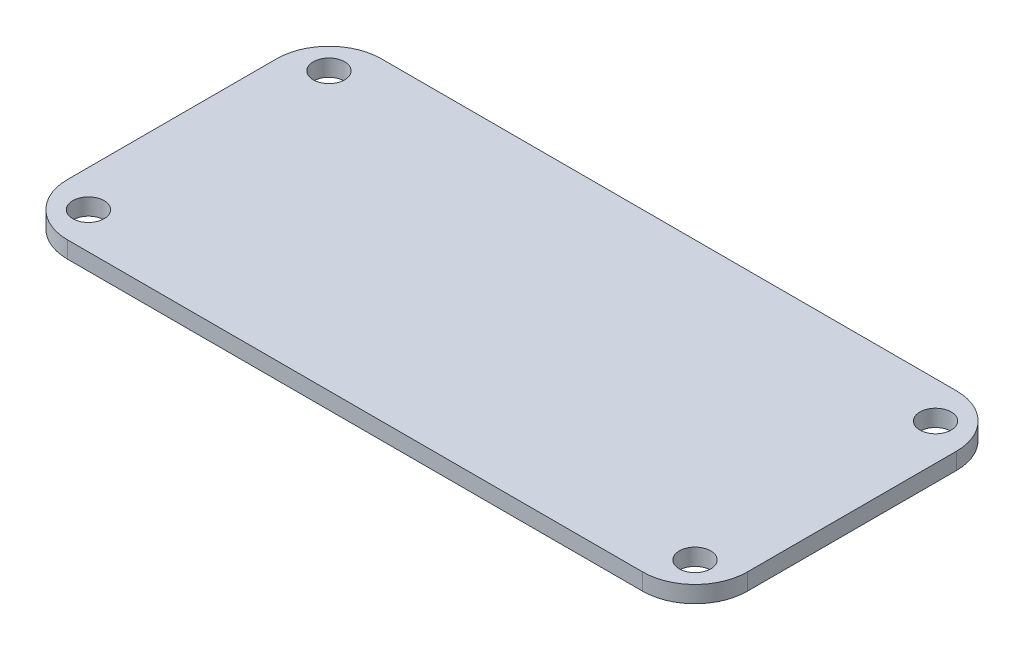
from build123d import *

# Parameters (mm, degrees)
ESQUISSE1_R        = 1.5
BOSS_EXTRU_1_DEPTH = 1.6


with BuildPart() as part:
    # Esquisse1 → Boss.-Extru.1 (new body)
    with BuildSketch(Plane(origin=(0, 0, 0), x_dir=(1, 0, 0), z_dir=(0, 1, 0))):
        with BuildLine():
            Line((-27.5, 15), (27.5, 15))
            ThreePointArc((27.5, 15), (31.035533906, 13.535533906), (32.5, 10))
            Line((32.5, 10), (32.5, -10))
            ThreePointArc((32.5, -10), (31.035533906, -13.535533906), (27.5, -15))
            Line((27.5, -15), (-27.5, -15))
            ThreePointArc((-27.5, -15), (-31.035533906, -13.535533906), (-32.5, -10))
            Line((-32.5, -10), (-32.5, 10))
            ThreePointArc((-32.5, 10), (-31.035533906, 13.535533906), (-27.5, 15))
        make_face()
        with Locations(Location((-29, 11.5, 0), (0, 0, 270))):
            Circle(ESQUISSE1_R, mode=Mode.SUBTRACT)
        with Locations(Location((29, 11.5, 0), (0, 0, 90))):
            Circle(ESQUISSE1_R, mode=Mode.SUBTRACT)
        with Locations(Location((29, -11.5, 0), (0, 0, 270))):
            Circle(ESQUISSE1_R, mode=Mode.SUBTRACT)
        with Locations(Location((-29, -11.5, 0), (0, 0, 90))):
            Circle(ESQUISSE1_R, mode=Mode.SUBTRACT)
    extrude(amount=BOSS_EXTRU_1_DEPTH)


solid = part.part
